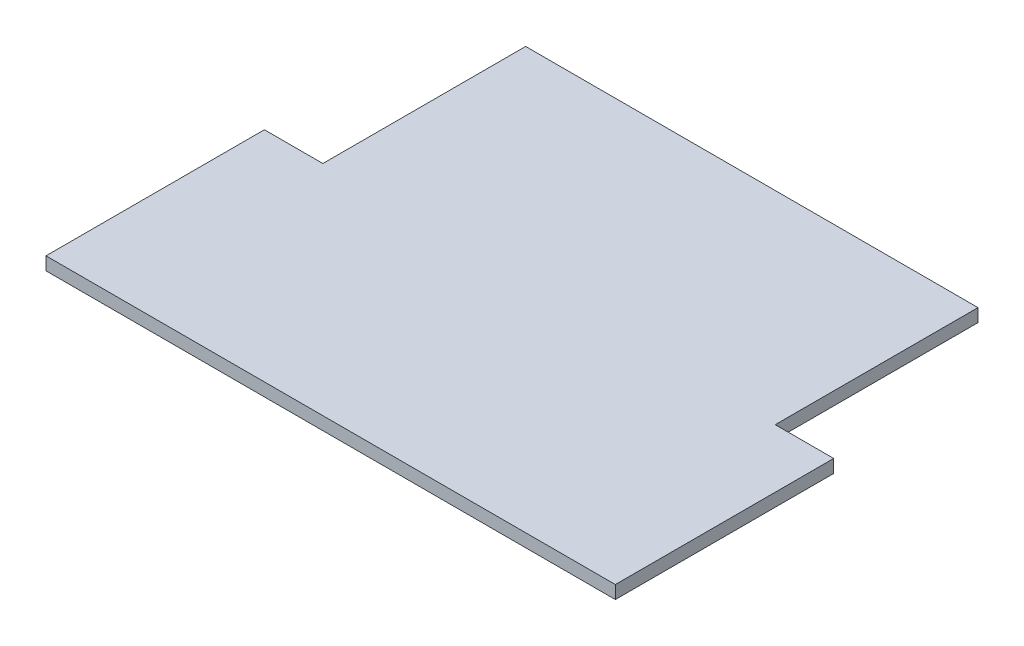
from build123d import *

# Parameters (mm, degrees)
BOSS_EXTRUDE1_DEPTH = 1.67


with BuildPart() as part:
    # Sketch1 → Boss-Extrude1 (new body)
    with BuildSketch(Plane(origin=(0, 0, 0), x_dir=(1, 0, 0), z_dir=(0, 1, 0))):
        Polygon((-36.5, -27), (-36.5, 1), (-29, 1), (-29, 27), (29, 27), (29, 1), (36.5, 1), (36.5, -27), align=None)
    extrude(amount=BOSS_EXTRUDE1_DEPTH)


solid = part.part
